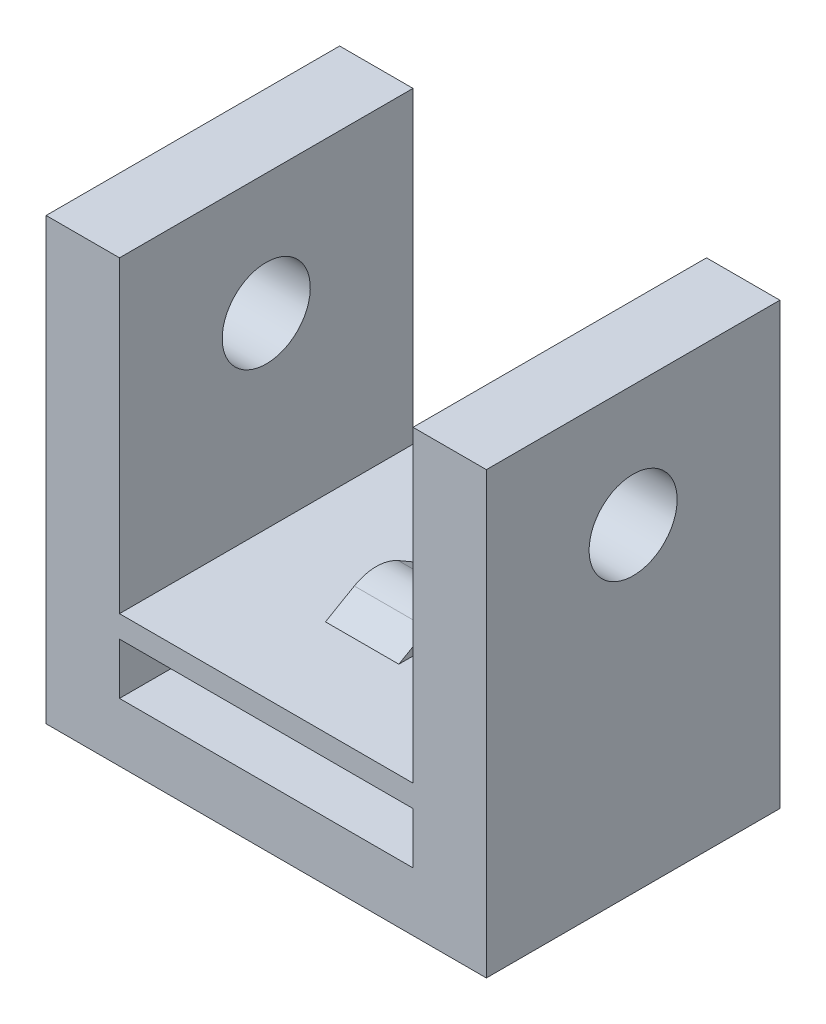
from build123d import *

# Parameters (mm, degrees)
SKETCH1_W           = 10
SKETCH1_H           = 1.75
BOSS_EXTRUDE1_DEPTH = 10
BOSS_EXTRUDE2_DEPTH = 1.25
SKETCH2_5_R         = 1.5
CUT_EXTRUDE1_DEPTH  = 25
FILLET1_R           = 1.5


with BuildPart() as part:
    # Sketch1 → Boss-Extrude1 (new body)
    with BuildSketch(Plane.XY):
        Polygon((-4.83125, 6.8625), (-7.33125, 6.8625), (-7.33125, -8.1375), (7.66875, -8.1375), (7.66875, 6.8625), (5.16875, 6.8625), (5.16875, -3.6375), (-4.83125, -3.6375), align=None)
        with Locations((0.16875, -5.2625)):
            Rectangle(SKETCH1_W, SKETCH1_H, mode=Mode.SUBTRACT)
    extrude(amount=BOSS_EXTRUDE1_DEPTH)

    # Sketch2 → Boss-Extrude2 (add, symmetric)
    with BuildSketch(Plane(origin=(0.16875, 0, 0), x_dir=(0, 0, -1), z_dir=(1, 0, 0))):
        Polygon((-5, -2.6375), (-6.732050808, -3.6375), (-3.267949192, -3.6375), align=None)
    extrude(amount=BOSS_EXTRUDE2_DEPTH, both=True)

    # Sketch2<5> → Cut-Extrude1 (cut, symmetric)
    with BuildSketch(Plane(origin=(0.16875, 0, 0), x_dir=(0, 0, -1), z_dir=(1, 0, 0))):
        with Locations((-5, 2.730596766)):
            Circle(SKETCH2_5_R)
    extrude(amount=CUT_EXTRUDE1_DEPTH, both=True, mode=Mode.SUBTRACT)

    # Fillet1
    fillet1_edges = [part.edges().sort_by_distance(p)[0] for p in [
        (0.16875, -2.6375, 5),
    ]]
    fillet(fillet1_edges, radius=FILLET1_R)


solid = part.part
